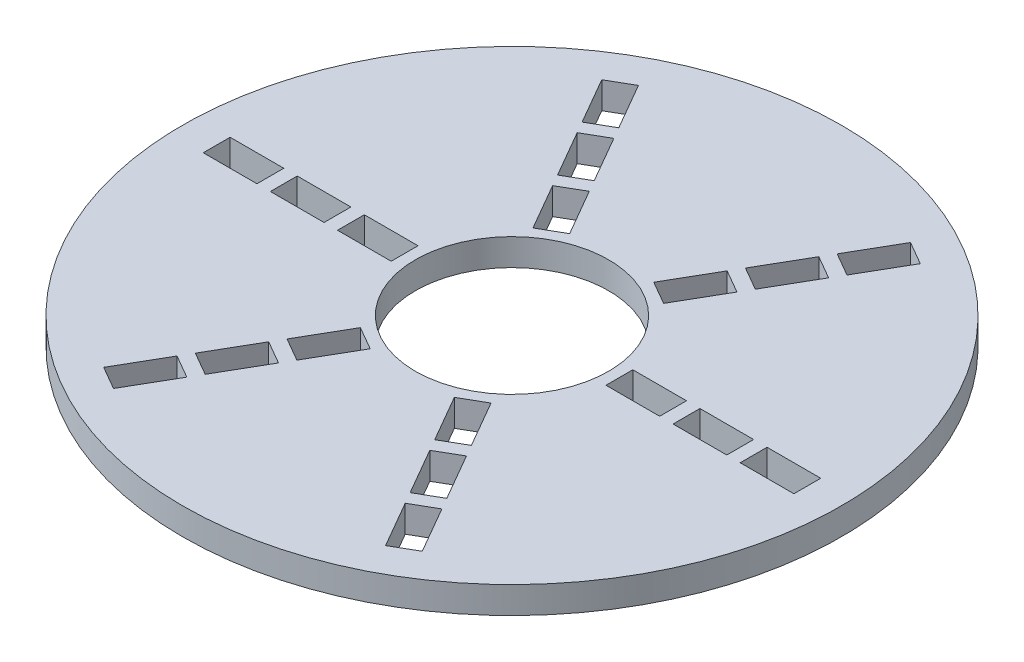
from build123d import *

# Parameters (mm, degrees)
SKETCH1_R           = 122.75
SKETCH1_R_2         = 36
SKETCH1_W           = 20
SKETCH1_H           = 10
BOSS_EXTRUDE1_DEPTH = 10


with BuildPart() as part:
    # Sketch1 → Boss-Extrude1 (new body)
    with BuildSketch(Plane(origin=(0, 0, 0), x_dir=(1, 0, 0), z_dir=(0, 1, 0))):
        Circle(SKETCH1_R)
        Circle(SKETCH1_R_2, mode=Mode.SUBTRACT)
        with Locations((75, 0)):
            Rectangle(SKETCH1_W, SKETCH1_H, mode=Mode.SUBTRACT)
        with Locations((50, 0)):
            Rectangle(SKETCH1_W, SKETCH1_H, mode=Mode.SUBTRACT)
        with Locations((100, 0)):
            Rectangle(SKETCH1_W, SKETCH1_H, mode=Mode.SUBTRACT)
        Polygon((15.669872981, -37.141016151), (24.330127019, -32.141016151), (34.330127019, -49.461524227), (25.669872981, -54.461524227), align=None, mode=Mode.SUBTRACT)
        Polygon((28.169872981, -58.791651246), (36.830127019, -53.791651246), (46.830127019, -71.112159322), (38.169872981, -76.112159322), align=None, mode=Mode.SUBTRACT)
        Polygon((40.669872981, -80.442286341), (49.330127019, -75.442286341), (59.330127019, -92.762794416), (50.669872981, -97.762794416), align=None, mode=Mode.SUBTRACT)
        Polygon((-24.330127019, -32.141016151), (-15.669872981, -37.141016151), (-25.669872981, -54.461524227), (-34.330127019, -49.461524227), align=None, mode=Mode.SUBTRACT)
        Polygon((-36.830127019, -53.791651246), (-28.169872981, -58.791651246), (-38.169872981, -76.112159322), (-46.830127019, -71.112159322), align=None, mode=Mode.SUBTRACT)
        Polygon((-49.330127019, -75.442286341), (-40.669872981, -80.442286341), (-50.669872981, -97.762794416), (-59.330127019, -92.762794416), align=None, mode=Mode.SUBTRACT)
        with Locations((-50, 0)):
            Rectangle(SKETCH1_W, SKETCH1_H, mode=Mode.SUBTRACT)
        with Locations((-75, 0)):
            Rectangle(SKETCH1_W, SKETCH1_H, mode=Mode.SUBTRACT)
        with Locations((-100, 0)):
            Rectangle(SKETCH1_W, SKETCH1_H, mode=Mode.SUBTRACT)
        Polygon((-15.669872981, 37.141016151), (-24.330127019, 32.141016151), (-34.330127019, 49.461524227), (-25.669872981, 54.461524227), align=None, mode=Mode.SUBTRACT)
        Polygon((-28.169872981, 58.791651246), (-36.830127019, 53.791651246), (-46.830127019, 71.112159322), (-38.169872981, 76.112159322), align=None, mode=Mode.SUBTRACT)
        Polygon((-40.669872981, 80.442286341), (-49.330127019, 75.442286341), (-59.330127019, 92.762794416), (-50.669872981, 97.762794416), align=None, mode=Mode.SUBTRACT)
        Polygon((24.330127019, 32.141016151), (15.669872981, 37.141016151), (25.669872981, 54.461524227), (34.330127019, 49.461524227), align=None, mode=Mode.SUBTRACT)
        Polygon((36.830127019, 53.791651246), (28.169872981, 58.791651246), (38.169872981, 76.112159322), (46.830127019, 71.112159322), align=None, mode=Mode.SUBTRACT)
        Polygon((49.330127019, 75.442286341), (40.669872981, 80.442286341), (50.669872981, 97.762794416), (59.330127019, 92.762794416), align=None, mode=Mode.SUBTRACT)
    extrude(amount=BOSS_EXTRUDE1_DEPTH)


solid = part.part
